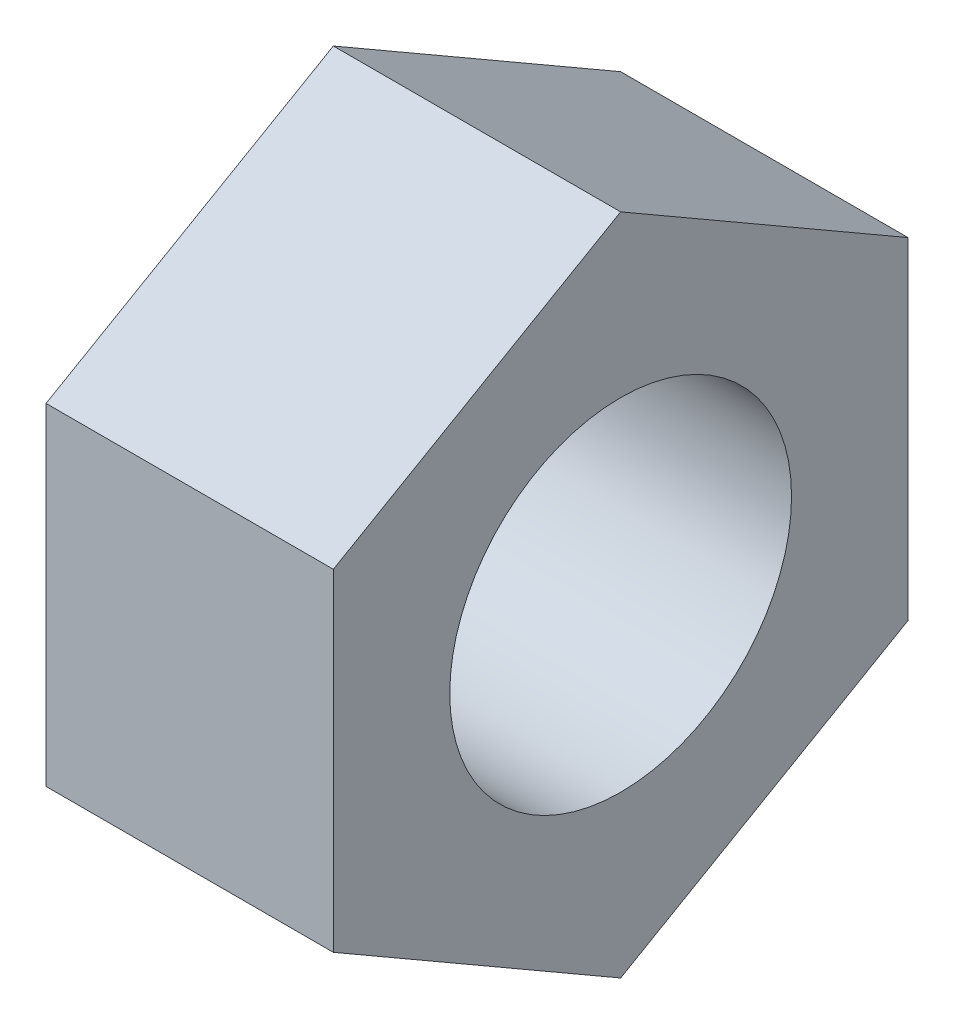
from build123d import *

# Parameters (mm, degrees)
HEX_HEAD_DEPTH     = 5.3375
SKETCH2_R          = 3.175
CUT_EXTRUDE1_DEPTH = 10.744897169


with BuildPart() as part:
    # Sketch1 → Hex_Head (new body)
    with BuildSketch(Plane(origin=(0, 0, 0), x_dir=(0, 0, -1), z_dir=(1, 0, 0))):
        Polygon((5.3375, -3.081607062), (5.3375, 3.081607062), (0, 6.163214124), (-5.3375, 3.081607062), (-5.3375, -3.081607062), (0, -6.163214124), align=None)
    extrude(amount=HEX_HEAD_DEPTH)

    # Sketch2 → Cut-Extrude1 (cut, through all)
    with BuildSketch(Plane.ZY):
        Circle(SKETCH2_R)
    extrude(amount=-CUT_EXTRUDE1_DEPTH, mode=Mode.SUBTRACT)


solid = part.part
